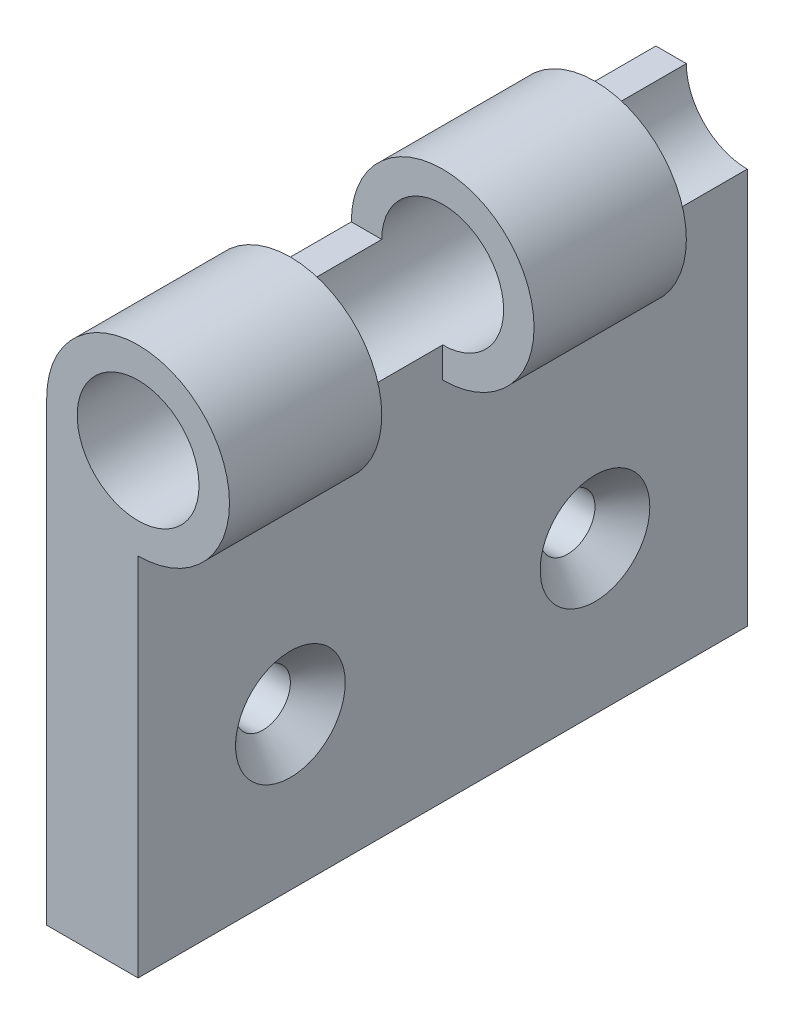
from build123d import *

# Parameters (mm, degrees)
SKETCH1_W                                            = 3
SKETCH1_H                                            = 15
BOSS_EXTRUDE1_DEPTH                                  = 20
SKETCH2_R                                            = 3
BOSS_EXTRUDE2_DEPTH                                  = 5
LPATTERN2_COUNT                                      = 2
LPATTERN2_PITCH                                      = 10
CUT_EXTRUDE1_DEPTH                                   = 26.709920264
CUT_EXTRUDE1_DEPTH_BACK                              = 26.709920264
SKETCH3_R                                            = 2
CSK_FOR_M1_6_COUNTERSUNK_FLAT_HEAD_SCREW_D           = 1.8
CSK_FOR_M1_6_COUNTERSUNK_FLAT_HEAD_SCREW_DEPTH       = 3
CSK_FOR_M1_6_COUNTERSUNK_FLAT_HEAD_SCREW_CSINK_D     = 3.6
CSK_FOR_M1_6_COUNTERSUNK_FLAT_HEAD_SCREW_CSINK_ANGLE = 90
CSK_FOR_M1_6_COUNTERSUNK_FLAT_HEAD_SCREW_TIP         = 0.540774557


with BuildPart() as part:
    # Sketch1 → Boss-Extrude1 (new body)
    with BuildSketch(Plane.XY):
        with Locations((1.5, -7.5)):
            Rectangle(SKETCH1_W, SKETCH1_H)
    extrude(amount=-BOSS_EXTRUDE1_DEPTH)

    # Sketch2 → Boss-Extrude2 (add)
    with BuildSketch(Plane.XY):
        with Locations((3, 0)):
            Circle(SKETCH2_R)
    boss_extrude2 = extrude(amount=-BOSS_EXTRUDE2_DEPTH)

    # LPattern2: Boss-Extrude2 ×2
    with Locations(*[(0, 0, -i * LPATTERN2_PITCH) for i in range(1, LPATTERN2_COUNT)]):
        add(boss_extrude2)

    # Sketch3 → Cut-Extrude1 (cut, two sides: drawn at the far end of the back side and taken through both)
    with BuildSketch(Plane.XY.offset(-CUT_EXTRUDE1_DEPTH_BACK)):
        with Locations((3, 0)):
            Circle(SKETCH3_R)
    extrude(amount=CUT_EXTRUDE1_DEPTH + CUT_EXTRUDE1_DEPTH_BACK, mode=Mode.SUBTRACT)

    # CSK for M1.6 Countersunk Flat Head Screw1
    with Locations(Plane(origin=(3, 0, 0), x_dir=(0, 0, -1), z_dir=(1, 0, 0))):
        with Locations((5, -10), (15, -10)):
            CounterSinkHole(CSK_FOR_M1_6_COUNTERSUNK_FLAT_HEAD_SCREW_D / 2, CSK_FOR_M1_6_COUNTERSUNK_FLAT_HEAD_SCREW_CSINK_D / 2, depth=CSK_FOR_M1_6_COUNTERSUNK_FLAT_HEAD_SCREW_DEPTH, counter_sink_angle=CSK_FOR_M1_6_COUNTERSUNK_FLAT_HEAD_SCREW_CSINK_ANGLE)
            with Locations((0, 0, -(CSK_FOR_M1_6_COUNTERSUNK_FLAT_HEAD_SCREW_DEPTH + CSK_FOR_M1_6_COUNTERSUNK_FLAT_HEAD_SCREW_TIP / 2))):  # 118° drill point
                Cone(0, CSK_FOR_M1_6_COUNTERSUNK_FLAT_HEAD_SCREW_D / 2, CSK_FOR_M1_6_COUNTERSUNK_FLAT_HEAD_SCREW_TIP, mode=Mode.SUBTRACT)


solid = part.part
